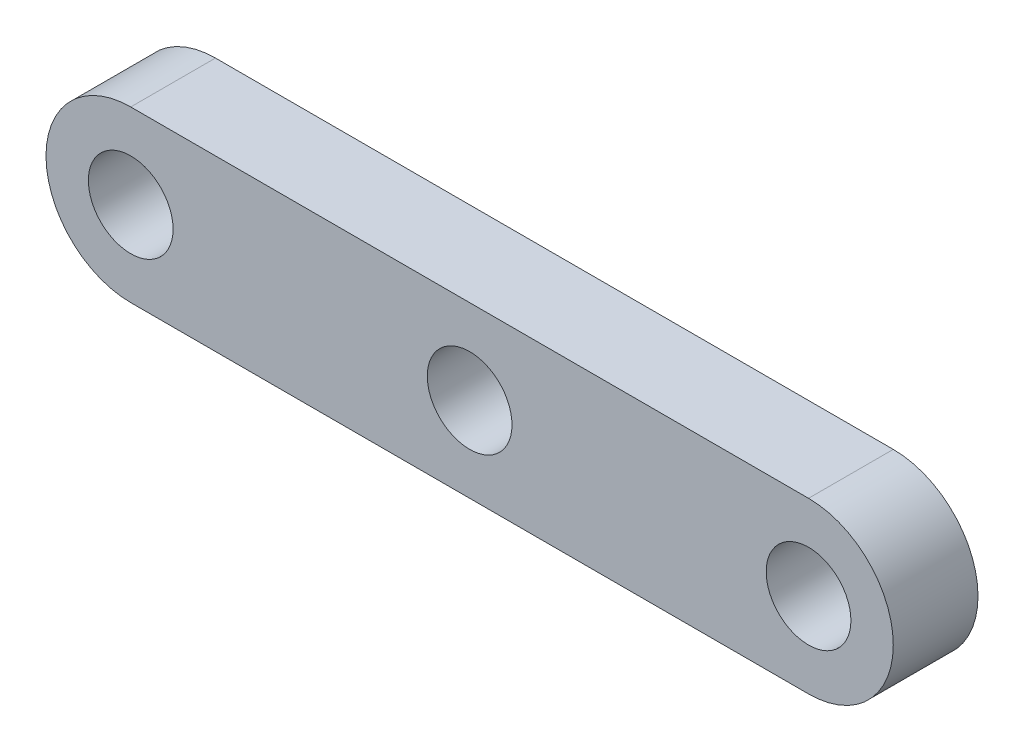
from build123d import *

# Parameters (mm, degrees)
BOSS_EXTRUDE1_DEPTH = 6.35
SKETCH3_R           = 3.175
CUT_EXTRUDE1_DEPTH  = 33.995567884


with BuildPart() as part:
    # Sketch2 → Boss-Extrude1 (new body)
    with BuildSketch(Plane.XY):
        with BuildLine():
            Line((25.4, -6.35), (-25.4, -6.35))
            ThreePointArc((-25.4, -6.35), (-31.75, 0), (-25.4, 6.35))
            Line((-25.4, 6.35), (25.4, 6.35))
            ThreePointArc((25.4, 6.35), (31.75, 0), (25.4, -6.35))
        make_face()
    extrude(amount=BOSS_EXTRUDE1_DEPTH)

    # Sketch3 → Cut-Extrude1 (cut, through all)
    with BuildSketch(Plane.XY.offset(6.35)):
        with Locations((-25.4, 0)):
            Circle(SKETCH3_R)
        Circle(SKETCH3_R)
        with Locations((25.4, 0)):
            Circle(SKETCH3_R)
    extrude(amount=-CUT_EXTRUDE1_DEPTH, mode=Mode.SUBTRACT)


solid = part.part
